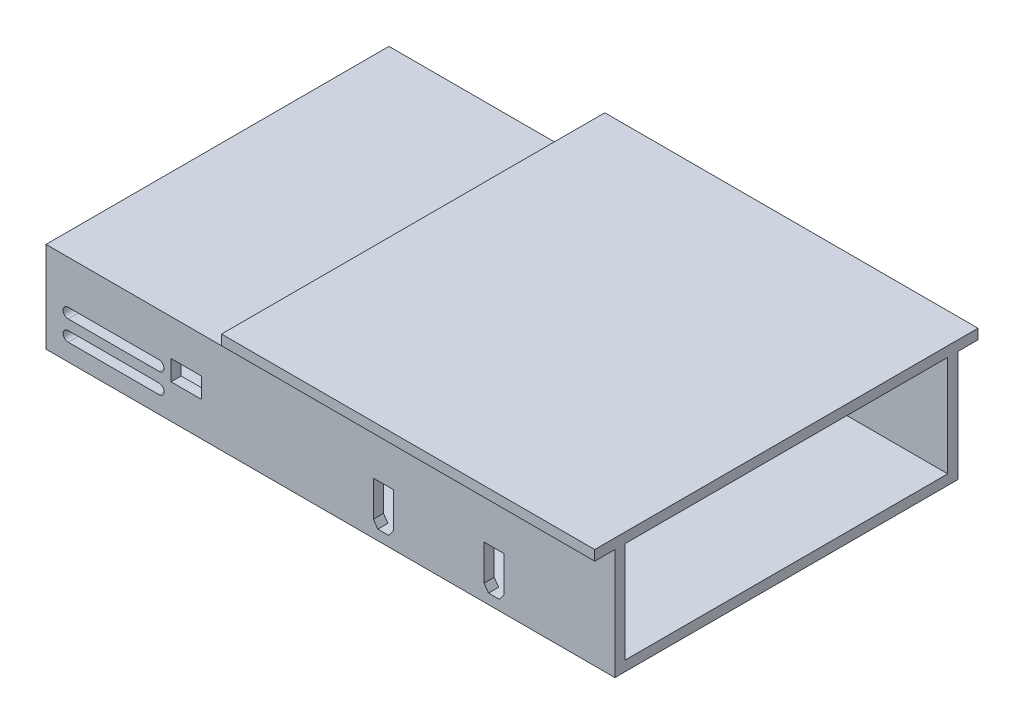
from build123d import *

# Parameters (mm, degrees)
SKETCH1_W           = 282
SKETCH1_H           = 170
BOSS_EXTRUDE1_DEPTH = 60
CUT_EXTRUDE4_DEPTH  = 5
SKETCH8_W           = 160
SKETCH8_H           = 50
CUT_EXTRUDE5_DEPTH  = 279
CUT_EXTRUDE6_DEPTH  = 5
SKETCH10_R          = 5
CUT_EXTRUDE7_DEPTH  = 5
CUT_EXTRUDE8_DEPTH  = 5
CUT_EXTRUDE9_START  = -5
CUT_EXTRUDE9_DEPTH  = 5
SKETCH14_W          = 185
SKETCH14_H          = 5
BOSS_EXTRUDE2_DEPTH = 10
SKETCH15_W          = 185
SKETCH15_H          = 5
BOSS_EXTRUDE3_DEPTH = 10
SKETCH16_W          = 97
SKETCH16_H          = 15
CUT_EXTRUDE10_DEPTH = 170
BOSS_EXTRUDE4_DEPTH = 160
SKETCH18_W          = 15
SKETCH18_H          = 10
CUT_EXTRUDE11_DEPTH = 340.888216918


with BuildPart() as part:
    # Sketch1 → Boss-Extrude1 (new body)
    with BuildSketch(Plane(origin=(0, 0, 0), x_dir=(1, 0, 0), z_dir=(0, 1, 0))):
        with Locations((141, 85)):
            Rectangle(SKETCH1_W, SKETCH1_H)
    extrude(amount=BOSS_EXTRUDE1_DEPTH)

    # Sketch7 → Cut-Extrude4 (cut)
    with BuildSketch(Plane.XZ):
        with BuildLine():
            Line((13.5, -37.5), (13.5, -132.5))
            ThreePointArc((13.5, -132.5), (11, -135), (8.5, -132.5))
            Line((8.5, -132.5), (8.5, -37.5))
            ThreePointArc((8.5, -37.5), (11, -35), (13.5, -37.5))
        make_face()
        with BuildLine():
            Line((58.5, -37.5), (58.5, -132.5))
            ThreePointArc((58.5, -132.5), (56, -135), (53.5, -132.5))
            Line((53.5, -132.5), (53.5, -37.5))
            ThreePointArc((53.5, -37.5), (56, -35), (58.5, -37.5))
        make_face()
        with BuildLine():
            Line((28.5, -37.5), (28.5, -132.5))
            ThreePointArc((28.5, -132.5), (26, -135), (23.5, -132.5))
            Line((23.5, -132.5), (23.5, -37.5))
            ThreePointArc((23.5, -37.5), (26, -35), (28.5, -37.5))
        make_face()
        with BuildLine():
            Line((43.5, -37.5), (43.5, -132.5))
            ThreePointArc((43.5, -132.5), (41, -135), (38.5, -132.5))
            Line((38.5, -132.5), (38.5, -37.5))
            ThreePointArc((38.5, -37.5), (41, -35), (43.5, -37.5))
        make_face()
    extrude(amount=-CUT_EXTRUDE4_DEPTH, mode=Mode.SUBTRACT)

    # Sketch8 → Cut-Extrude5 (cut)
    with BuildSketch(Plane(origin=(282, 0, 0), x_dir=(0, 0, -1), z_dir=(1, 0, 0))):
        with Locations((85, 30)):
            Rectangle(SKETCH8_W, SKETCH8_H)
    extrude(amount=-CUT_EXTRUDE5_DEPTH, mode=Mode.SUBTRACT)

    # Sketch9 → Cut-Extrude6 (cut)
    with BuildSketch(Plane.XY):
        Polygon((217.15, 25.8), (227.05, 25.8), (227.05, 8.15), (224.8, 5), (219.4, 5), (217.15, 8.15), align=None)
        Polygon((162.25, 25.8), (172.15, 25.8), (172.15, 8.15), (169.9, 5), (164.5, 5), (162.25, 8.15), align=None)
    extrude(amount=-CUT_EXTRUDE6_DEPTH, mode=Mode.SUBTRACT)

    # Sketch10 → Cut-Extrude7 (cut)
    with BuildSketch(Plane.ZY):
        with Locations((-129.202249563, 20)):
            Circle(SKETCH10_R)
        with Locations((-114.202249563, 20)):
            Circle(SKETCH10_R)
        with Locations((-99.202249563, 20)):
            Circle(SKETCH10_R)
        with Locations((-43.390057257, 20)):
            Circle(SKETCH10_R)
        with Locations((-58.390057257, 20)):
            Circle(SKETCH10_R)
        with Locations((-73.390057257, 20)):
            Circle(SKETCH10_R)
    extrude(amount=-CUT_EXTRUDE7_DEPTH, mode=Mode.SUBTRACT)

    # Sketch11 → Cut-Extrude8 (cut)
    with BuildSketch(Plane.XY):
        with BuildLine():
            Line((11, 13.5), (56, 13.5))
            ThreePointArc((56, 13.5), (58.5, 11), (56, 8.5))
            Line((56, 8.5), (11, 8.5))
            ThreePointArc((11, 8.5), (8.5, 11), (11, 13.5))
        make_face()
        with BuildLine():
            Line((11, 23.5), (56, 23.5))
            ThreePointArc((56, 23.5), (58.5, 21), (56, 18.5))
            Line((56, 18.5), (11, 18.5))
            ThreePointArc((11, 18.5), (8.5, 21), (11, 23.5))
        make_face()
    extrude(amount=-CUT_EXTRUDE8_DEPTH, mode=Mode.SUBTRACT)

    # Sketch12 → Cut-Extrude9 (cut)
    with BuildSketch(Plane(origin=(0, 0, -170), x_dir=(-1, 0, 0), z_dir=(0, 0, -1)).offset(CUT_EXTRUDE9_START)):
        with BuildLine():
            Line((-56, 13.5), (-11, 13.5))
            ThreePointArc((-11, 13.5), (-8.5, 11), (-11, 8.5))
            Line((-11, 8.5), (-56, 8.5))
            ThreePointArc((-56, 8.5), (-58.5, 11), (-56, 13.5))
        make_face()
        with BuildLine():
            Line((-56, 23.5), (-11, 23.5))
            ThreePointArc((-11, 23.5), (-8.5, 21), (-11, 18.5))
            Line((-11, 18.5), (-56, 18.5))
            ThreePointArc((-56, 18.5), (-58.5, 21), (-56, 23.5))
        make_face()
    extrude(amount=CUT_EXTRUDE9_DEPTH, mode=Mode.SUBTRACT)

    # Sketch14 → Boss-Extrude2 (add)
    with BuildSketch(Plane.XY):
        with Locations((189.5, 57.5)):
            Rectangle(SKETCH14_W, SKETCH14_H)
    extrude(amount=BOSS_EXTRUDE2_DEPTH)

    # Sketch15 → Boss-Extrude3 (add)
    with BuildSketch(Plane(origin=(0, 0, -170), x_dir=(-1, 0, 0), z_dir=(0, 0, -1))):
        with Locations((-189.5, 57.5)):
            Rectangle(SKETCH15_W, SKETCH15_H)
    extrude(amount=BOSS_EXTRUDE3_DEPTH)

    # Sketch16 → Cut-Extrude10 (cut)
    with BuildSketch(Plane.XY):
        with Locations((48.5, 52.5)):
            Rectangle(SKETCH16_W, SKETCH16_H)
    extrude(amount=-CUT_EXTRUDE10_DEPTH, mode=Mode.SUBTRACT)

    # Sketch17 → Boss-Extrude4 (add)
    with BuildSketch(Plane.XY.offset(-165)):
        Polygon((3, 45), (97, 45), (97, 55), (102, 55), (102, 40), (3, 40), align=None)
    extrude(amount=BOSS_EXTRUDE4_DEPTH)

    # Sketch18 → Cut-Extrude11 (cut, through all)
    with BuildSketch(Plane.XY):
        with Locations((69.5, 22)):
            Rectangle(SKETCH18_W, SKETCH18_H)
    extrude(amount=-CUT_EXTRUDE11_DEPTH, mode=Mode.SUBTRACT)


solid = part.part
